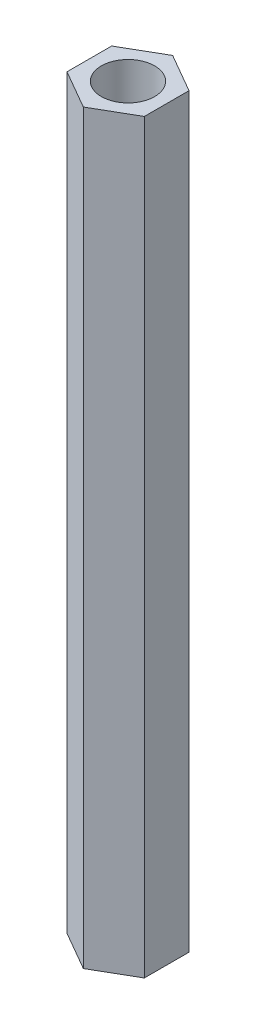
from build123d import *

# Parameters (mm, degrees)
SKETCH_1_R      = 1.5
EXTRUDE_1_DEPTH = 42


with BuildPart() as part:
    # 草图1 → 凸台-拉伸1 (new body)
    with BuildSketch(Plane(origin=(0, 0, 0), x_dir=(1, 0, 0), z_dir=(0, 1, 0))):
        Polygon((0, 2.513901358), (-2.177102439, 1.256950679), (-2.177102439, -1.256950679), (0, -2.513901358), (2.177102439, -1.256950679), (2.177102439, 1.256950679), align=None)
        with Locations(Location((0, 0, 0), (0, 0, 90))):
            Circle(SKETCH_1_R, mode=Mode.SUBTRACT)
    extrude(amount=EXTRUDE_1_DEPTH)


solid = part.part
